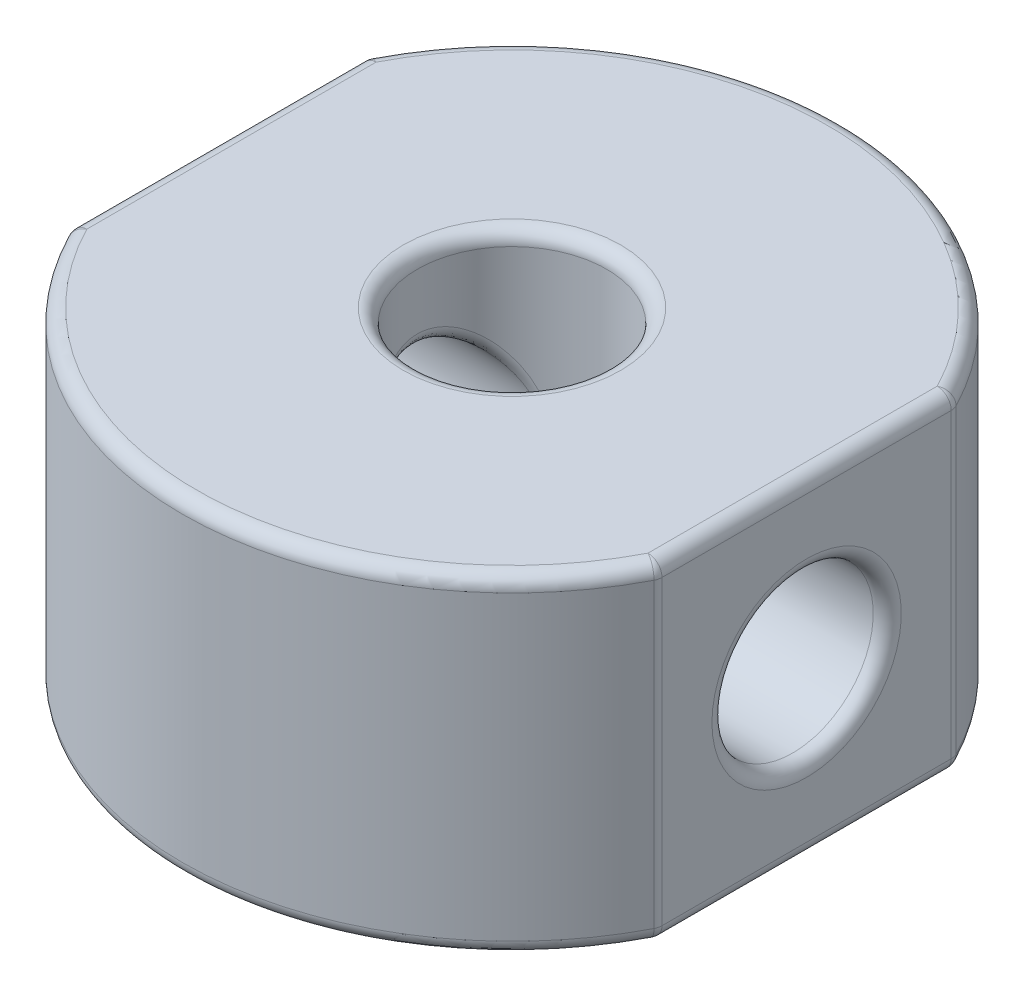
from build123d import *

# Parameters (mm, degrees)
SKETCH1_R           = 2.7
BOSS_EXTRUDE1_DEPTH = 9.4
SKETCH2_R           = 2.3
CUT_EXTRUDE1_DEPTH  = 22.423351745
FILLET1_R           = 0.4


with BuildPart() as part:
    # Sketch1 → Boss-Extrude1 (new body)
    with BuildSketch(Plane(origin=(0, 0, 0), x_dir=(1, 0, 0), z_dir=(0, 1, 0))):
        with BuildLine():
            ThreePointArc((-8.4, -4.219004622), (0, -9.4), (8.4, -4.219004622))
            Line((8.4, -4.219004622), (8.4, 4.219004622))
            ThreePointArc((8.4, 4.219004622), (0, 9.4), (-8.4, 4.219004622))
            Line((-8.4, 4.219004622), (-8.4, -4.219004622))
        make_face()
        with Locations(Location((0, 0, 0), (0, 0, 90))):
            Circle(SKETCH1_R, mode=Mode.SUBTRACT)
    extrude(amount=BOSS_EXTRUDE1_DEPTH)

    # Sketch2 → Cut-Extrude1 (cut, through all)
    with BuildSketch(Plane.ZY.offset(8.4)):
        with Locations((0, 4.7)):
            Circle(SKETCH2_R)
    extrude(amount=-CUT_EXTRUDE1_DEPTH, mode=Mode.SUBTRACT)

    # Fillet1
    fillet1_edges = [part.edges().sort_by_distance(p)[0] for p in [
        (8.4, 9.4, 0),
        (8.4, 4.7, 4.219004622),
        (-8.4, 4.7, 4.219004622),
        (-8.4, 4.7, -4.219004622),
        (8.4, 4.7, -4.219004622),
        (0, 9.4, -9.4),
        (-8.4, 9.4, 0),
        (-1.414213562, 4.7, -2.3),
        (1.414213562, 4.7, -2.3),
        (8.4, 4.7, -2.3),
        (-8.4, 4.7, -2.3),
        (0, 9.4, 9.4),
        (0, 9.4, 2.7),
        (0, 0, 9.4),
        (-8.4, 0, 0),
        (0, 0, -9.4),
        (8.4, 0, 0),
        (0, 0, 2.7),
    ]]
    fillet(fillet1_edges, radius=FILLET1_R)


solid = part.part
